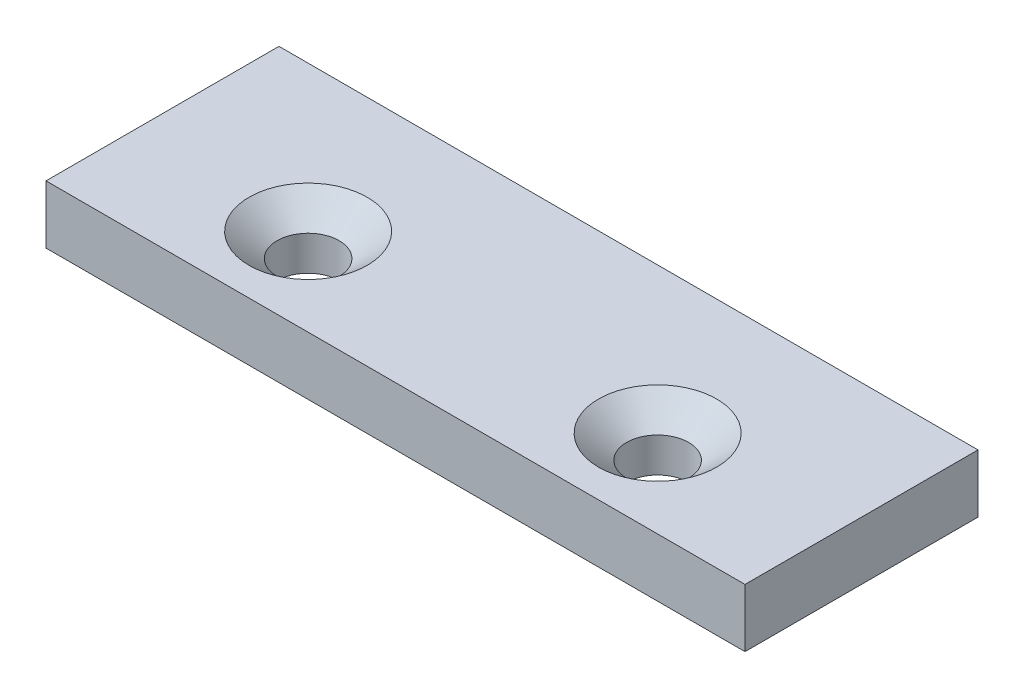
from build123d import *

# Parameters (mm, degrees)
SKETCH1_W                                           = 76.2
SKETCH1_H                                           = 25.4
BOSS_EXTRUDE1_DEPTH                                 = 6.35
CSK_FOR_1_4_FLAT_HEAD_MACHINE_SCREW_100_D           = 6.7564
CSK_FOR_1_4_FLAT_HEAD_MACHINE_SCREW_100_CSINK_D     = 12.8778
CSK_FOR_1_4_FLAT_HEAD_MACHINE_SCREW_100_CSINK_ANGLE = 100


with BuildPart() as part:
    # Sketch1 → Boss-Extrude1 (new body)
    with BuildSketch(Plane(origin=(0, 0, 0), x_dir=(1, 0, 0), z_dir=(0, 1, 0))):
        with Locations((38.1, 12.7)):
            Rectangle(SKETCH1_W, SKETCH1_H)
    extrude(amount=-BOSS_EXTRUDE1_DEPTH)

    # CSK for 1/4 Flat Head Machine Screw (100)1 (through all)
    with Locations(Plane(origin=(0, 0, 0), x_dir=(1, 0, 0), z_dir=(0, 1, 0))):
        with Locations((19.05, 9.525), (57.15, 9.525)):
            CounterSinkHole(CSK_FOR_1_4_FLAT_HEAD_MACHINE_SCREW_100_D / 2, CSK_FOR_1_4_FLAT_HEAD_MACHINE_SCREW_100_CSINK_D / 2, counter_sink_angle=CSK_FOR_1_4_FLAT_HEAD_MACHINE_SCREW_100_CSINK_ANGLE)


solid = part.part
